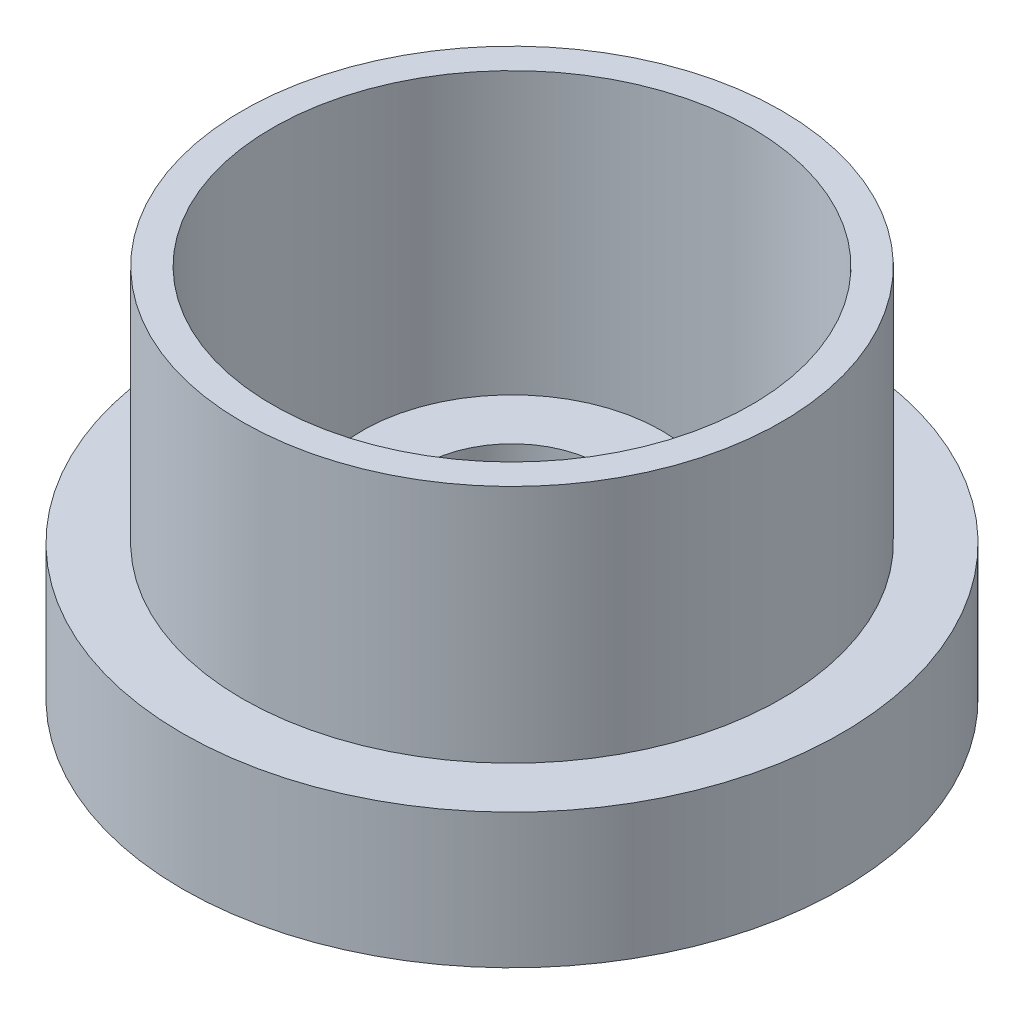
from build123d import *


with BuildPart() as part:
    # Esquisse1 → Base-Révolution (revolve)
    with BuildSketch(Plane.XY, mode=Mode.PRIVATE) as base_r_volution_sk:
        Polygon((-6, 0), (-6, 10.5), (-10, 10.5), (-10, 5), (-16, 5), (-16, 25), (-18, 25), (-18, 9), (-22, 9), (-22, 0), align=None)
    revolve(base_r_volution_sk.sketch.rotate(Axis((0, -75.104513541, 0), (0, 1, 0)), 270), axis=Axis((0, -75.104513541, 0), (0, 1, 0)))


solid = part.part
